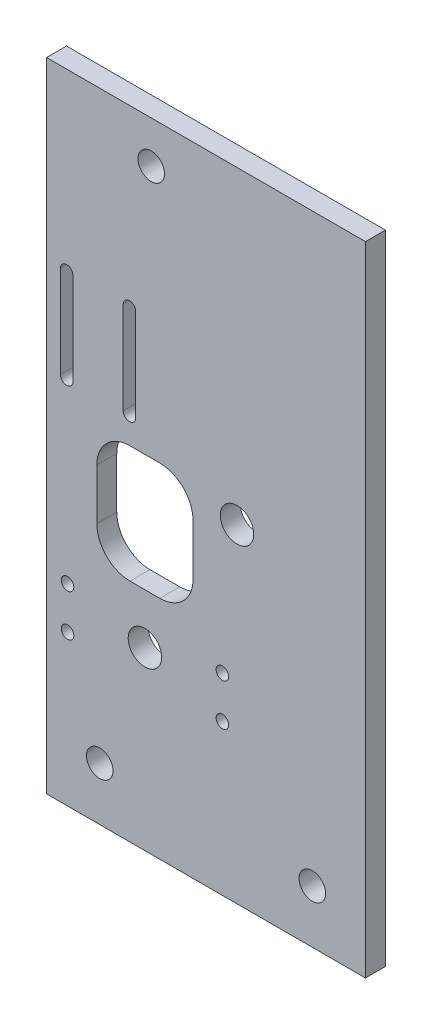
from build123d import *

# Parameters (mm, degrees)
SKETCH1_W           = 76.2
SKETCH1_H           = 4.7625
BOSS_EXTRUDE1_DEPTH = 152.4
SKETCH2_R           = 4
CUT_EXTRUDE1_DEPTH  = 171.454924852
SKETCH3_W           = 23
SKETCH3_H           = 28
CUT_EXTRUDE2_DEPTH  = 171.454924852
FILLET1_R           = 7.9375
CUT_EXTRUDE3_DEPTH  = 171.454924852
SKETCH5_R           = 1.5
CUT_EXTRUDE4_DEPTH  = 171.454924852
SKETCH6_R           = 3.175
CUT_EXTRUDE5_DEPTH  = 171.454924852
SKETCH7_R           = 3.175
CUT_EXTRUDE6_DEPTH  = 171.454924852


with BuildPart() as part:
    # Sketch1 → Boss-Extrude1 (new body)
    with BuildSketch(Plane(origin=(0, 0, 0), x_dir=(1, 0, 0), z_dir=(0, 1, 0))):
        with Locations((38.1, 2.38125)):
            Rectangle(SKETCH1_W, SKETCH1_H)
    extrude(amount=BOSS_EXTRUDE1_DEPTH)

    # Sketch2 → Cut-Extrude1 (cut, through all)
    with BuildSketch(Plane.XY):
        with Locations((23.5, 42)):
            Circle(SKETCH2_R)
        with Locations((45.5, 78.451705922)):
            Circle(SKETCH2_R)
    extrude(amount=-CUT_EXTRUDE1_DEPTH, mode=Mode.SUBTRACT)

    # Sketch3 → Cut-Extrude2 (cut, through all)
    with BuildSketch(Plane.XY):
        with Locations((23.5, 68)):
            Rectangle(SKETCH3_W, SKETCH3_H)
    extrude(amount=-CUT_EXTRUDE2_DEPTH, mode=Mode.SUBTRACT)

    # Fillet1
    fillet1_edges = [part.edges().sort_by_distance(p)[0] for p in [
        (12, 54, -2.38125),
        (12, 82, -2.38125),
        (35, 82, -2.38125),
        (35, 54, -2.38125),
    ]]
    fillet(fillet1_edges, radius=FILLET1_R)

    # Sketch4 → Cut-Extrude3 (cut, through all)
    with BuildSketch(Plane.XY):
        with BuildLine():
            Line((6.3, 110.451705922), (6.3, 88.451705922))
            ThreePointArc((6.3, 88.451705922), (4.8, 86.951705922), (3.3, 88.451705922))
            Line((3.3, 88.451705922), (3.3, 110.451705922))
            ThreePointArc((3.3, 110.451705922), (4.8, 111.951705922), (6.3, 110.451705922))
        make_face()
        with BuildLine():
            Line((21.3, 110.451705922), (21.3, 88.451705922))
            ThreePointArc((21.3, 88.451705922), (19.8, 86.951705922), (18.3, 88.451705922))
            Line((18.3, 88.451705922), (18.3, 110.451705922))
            ThreePointArc((18.3, 110.451705922), (19.8, 111.951705922), (21.3, 110.451705922))
        make_face()
    extrude(amount=-CUT_EXTRUDE3_DEPTH, mode=Mode.SUBTRACT)

    # Sketch5 → Cut-Extrude4 (cut, through all)
    with BuildSketch(Plane.XY):
        with Locations((5, 36)):
            Circle(SKETCH5_R)
        with Locations((42, 36)):
            Circle(SKETCH5_R)
        with Locations((5, 46)):
            Circle(SKETCH5_R)
        with Locations((42, 46)):
            Circle(SKETCH5_R)
    extrude(amount=-CUT_EXTRUDE4_DEPTH, mode=Mode.SUBTRACT)

    # Sketch6 → Cut-Extrude5 (cut, through all)
    with BuildSketch(Plane.XY):
        with Locations((12.7, 12.7)):
            Circle(SKETCH6_R)
        with Locations((63.5, 12.7)):
            Circle(SKETCH6_R)
    extrude(amount=-CUT_EXTRUDE5_DEPTH, mode=Mode.SUBTRACT)

    # Sketch7 → Cut-Extrude6 (cut, through all)
    with BuildSketch(Plane.XY):
        with Locations((25, 142.4)):
            Circle(SKETCH7_R)
    extrude(amount=-CUT_EXTRUDE6_DEPTH, mode=Mode.SUBTRACT)


solid = part.part
